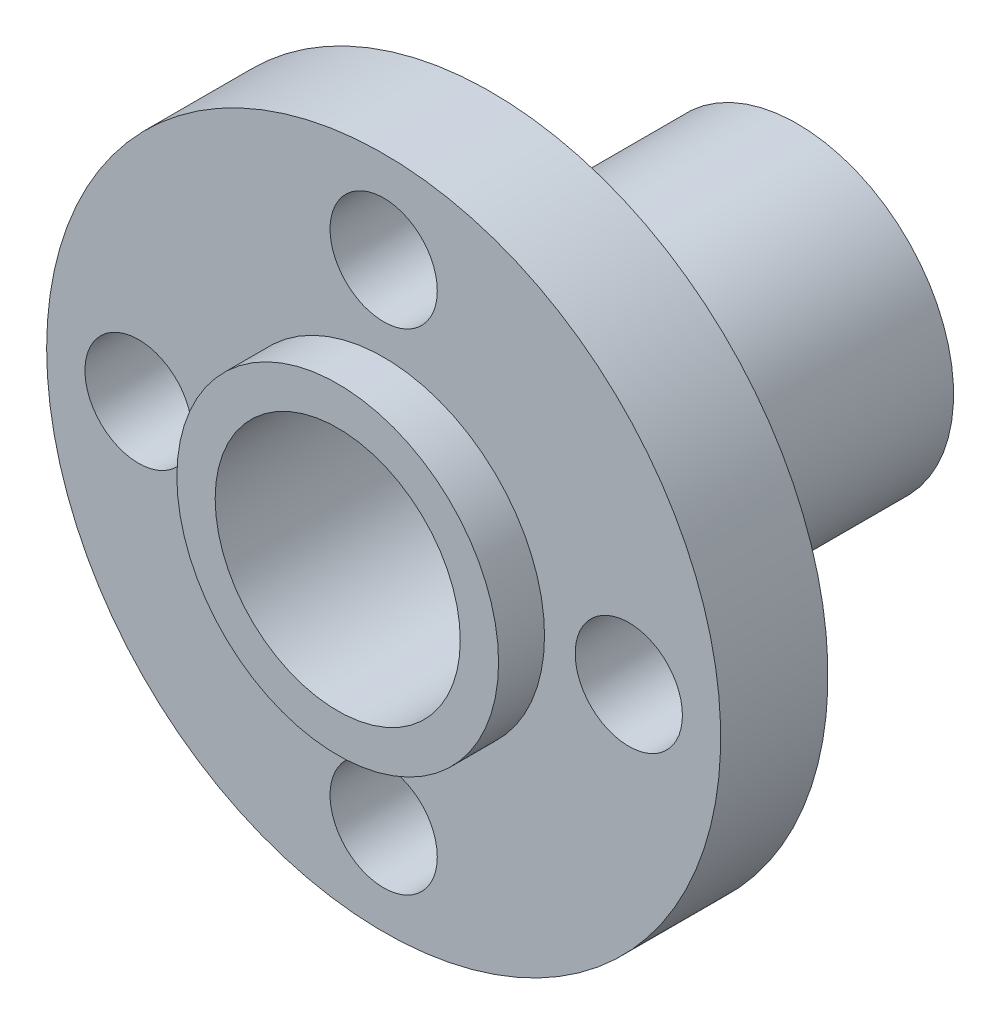
from build123d import *

# Parameters (mm, degrees)
SKETCH1_R           = 5.25
BOSS_EXTRUDE1_DEPTH = 1.5
SKETCH2_R           = 11
BOSS_EXTRUDE2_DEPTH = 3.5
SKETCH3_R           = 5.1
BOSS_EXTRUDE3_DEPTH = 10
SKETCH4_R           = 4
CUT_EXTRUDE1_DEPTH  = 22.610182785
SKETCH5_R           = 1.75
CUT_EXTRUDE2_DEPTH  = 10


with BuildPart() as part:
    # Sketch1 → Boss-Extrude1 (new body)
    with BuildSketch(Plane.XY):
        Circle(SKETCH1_R)
    extrude(amount=-BOSS_EXTRUDE1_DEPTH)

    # Sketch2 → Boss-Extrude2 (add)
    with BuildSketch(Plane(origin=(0, 0, -1.5), x_dir=(-1, 0, 0), z_dir=(0, 0, -1))):
        Circle(SKETCH2_R)
    extrude(amount=BOSS_EXTRUDE2_DEPTH)

    # Sketch3 → Boss-Extrude3 (add)
    with BuildSketch(Plane(origin=(0, 0, -5), x_dir=(-1, 0, 0), z_dir=(0, 0, -1))):
        Circle(SKETCH3_R)
    extrude(amount=BOSS_EXTRUDE3_DEPTH)

    # Sketch4 → Cut-Extrude1 (cut, through all)
    with BuildSketch(Plane(origin=(0, 0, -15), x_dir=(-1, 0, 0), z_dir=(0, 0, -1))):
        Circle(SKETCH4_R)
    extrude(amount=-CUT_EXTRUDE1_DEPTH, mode=Mode.SUBTRACT)

    # Sketch5 → Cut-Extrude2 (cut)
    with BuildSketch(Plane.XY.offset(-1.5)):
        with Locations((-8, 0)):
            Circle(SKETCH5_R)
        with Locations((0, 8)):
            Circle(SKETCH5_R)
        with Locations((8, 0)):
            Circle(SKETCH5_R)
        with Locations((0, -8)):
            Circle(SKETCH5_R)
    extrude(amount=-CUT_EXTRUDE2_DEPTH, mode=Mode.SUBTRACT)


solid = part.part
